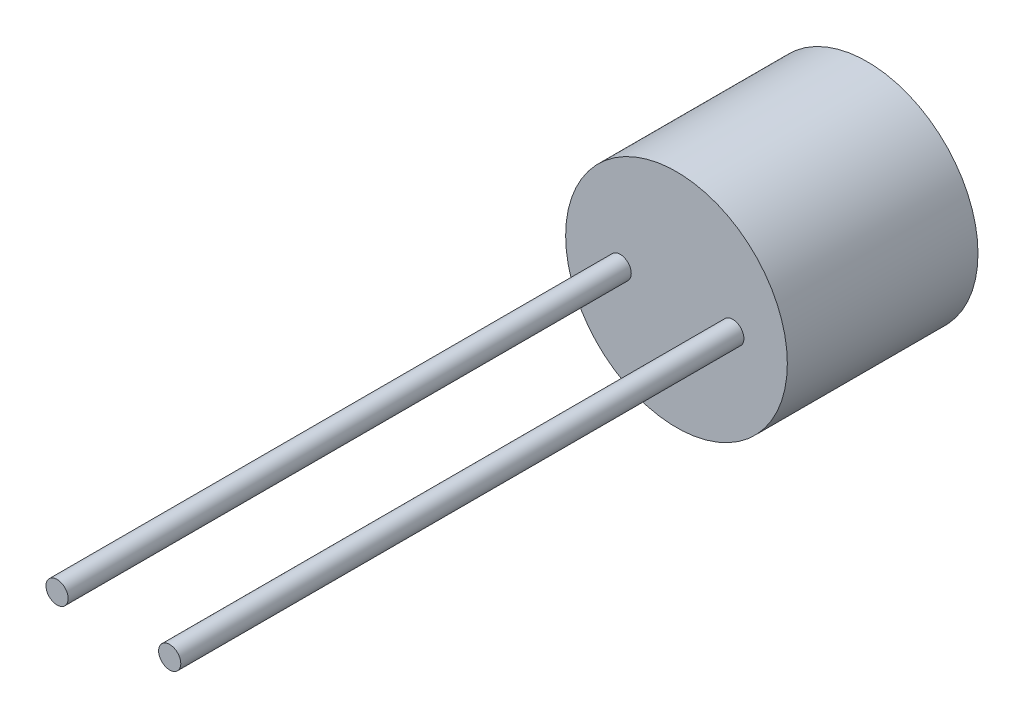
from build123d import *

# Parameters (mm, degrees)
SKETCH_1_R      = 2.5
EXTRUDE_1_DEPTH = 3.3
SKETCH_2_R      = 2.5
EXTRUDE_2_DEPTH = 1
SKETCH_3_R      = 0.25
EXTRUDE_3_DEPTH = 12.7


with BuildPart() as part:
    # 草图1 → 拉伸1 (new body)
    with BuildSketch(Plane.XY):
        Circle(SKETCH_1_R)
    extrude(amount=EXTRUDE_1_DEPTH)

    # 草图2 → 拉伸2 (add)
    with BuildSketch(Plane.XY.offset(3.3)):
        Circle(SKETCH_2_R)
    extrude(amount=EXTRUDE_2_DEPTH)

    # 草图3 → 拉伸3 (add)
    with BuildSketch(Plane.XY.offset(4.3)):
        with Locations((-1.27, 0)):
            Circle(SKETCH_3_R)
        with Locations(Location((1.27, 0, 0), (0, 0, 180))):
            Circle(SKETCH_3_R)
    extrude(amount=EXTRUDE_3_DEPTH)


solid = part.part
